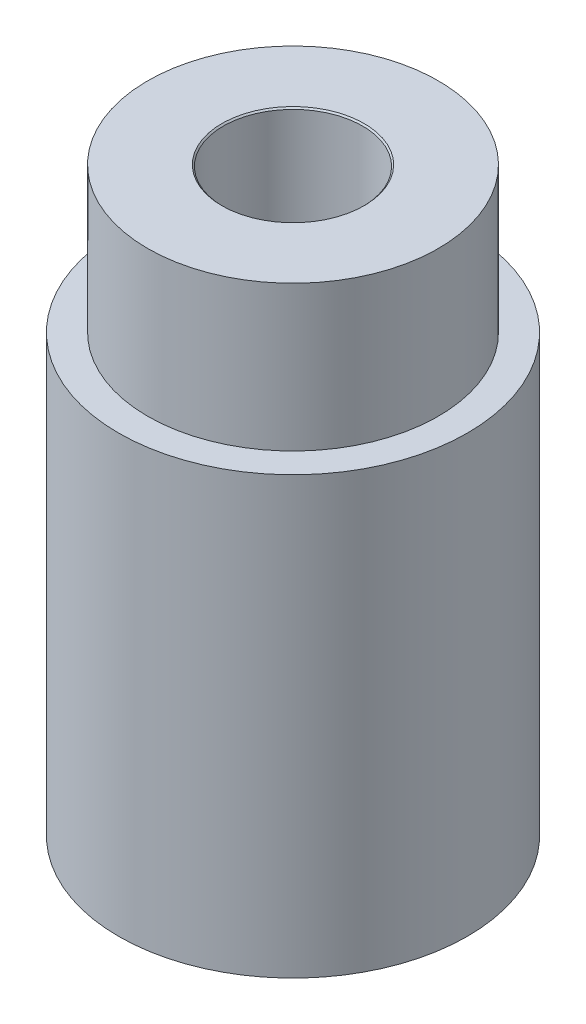
from build123d import *

# Parameters (mm, degrees)
SKETCH1_R                      = 3
BOSS_EXTRUDE1_DEPTH            = 7.5
SKETCH2_R                      = 2.5
BOSS_EXTRUDE2_DEPTH            = 2.5
M2_CLEARANCE_HOLE1_D           = 2.4
M2_CLEARANCE_HOLE1_CSINK_D     = 2.45
M2_CLEARANCE_HOLE1_CSINK_ANGLE = 90


with BuildPart() as part:
    # Sketch1 → Boss-Extrude1 (new body)
    with BuildSketch(Plane(origin=(0, 0, 0), x_dir=(1, 0, 0), z_dir=(0, 1, 0))):
        with Locations(Location((0, 0, 0), (0, 0, 270))):
            Circle(SKETCH1_R)
    extrude(amount=BOSS_EXTRUDE1_DEPTH)

    # Sketch2 → Boss-Extrude2 (add)
    with BuildSketch(Plane(origin=(0, 7.5, 0), x_dir=(1, 0, 0), z_dir=(0, 1, 0))):
        with Locations(Location((0, 0, 0), (0, 0, 270))):
            Circle(SKETCH2_R)
    extrude(amount=BOSS_EXTRUDE2_DEPTH)

    # M2 Clearance Hole1 (through all)
    with Locations(Plane(origin=(0, 10, 0), x_dir=(1, 0, 0), z_dir=(0, 1, 0))):
        with Locations((0, 0)):
            CounterSinkHole(M2_CLEARANCE_HOLE1_D / 2, M2_CLEARANCE_HOLE1_CSINK_D / 2, counter_sink_angle=M2_CLEARANCE_HOLE1_CSINK_ANGLE)


solid = part.part
